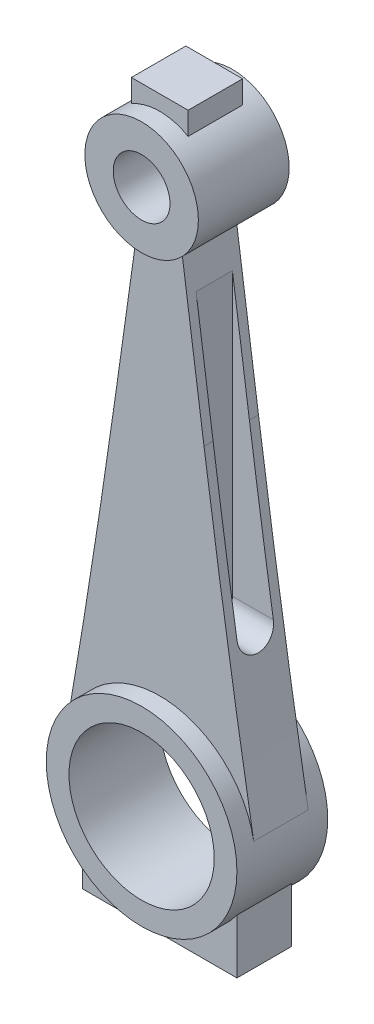
from build123d import *

# Parameters (mm, degrees)
SKETCH2_R             = 12.5
SKETCH2_R_2           = 6.25
BOSS_EXTRUDE3_DEPTH   = 10
SKETCH2_R_3           = 21
SKETCH2_R_4           = 16
BOSS_EXTRUDE3_2_DEPTH = 10
BOSS_EXTRUDE4_DEPTH   = 6
CUT_EXTRUDE2_START    = -6
CUT_EXTRUDE2_DEPTH    = 132.802456026
CUT_EXTRUDE3_START    = 6
CUT_EXTRUDE3_DEPTH    = 132.802456026


with BuildPart() as part:
    # Sketch2 → Boss-Extrude3 (new, symmetric)
    with BuildSketch(Plane.XY):
        with Locations((0, 120)):
            Circle(SKETCH2_R)
        with Locations((0, 120)):
            Circle(SKETCH2_R_2, mode=Mode.SUBTRACT)
    extrude(amount=BOSS_EXTRUDE3_DEPTH, both=True)



with BuildPart() as body_2:
    # Sketch2 → Boss-Extrude3 2 (new, symmetric)
    with BuildSketch(Plane.XY):
        Circle(SKETCH2_R_3)
        Circle(SKETCH2_R_4, mode=Mode.SUBTRACT)
    extrude(amount=BOSS_EXTRUDE3_2_DEPTH, both=True)


with BuildPart() as part_1:
    add(part.part)

    add(body_2.part)  # Boss-Extrude4 merges body 2
    # Sketch2<6> → Boss-Extrude4 (add, symmetric)
    with BuildSketch(Plane.XY):
        with BuildLine():
            Line((6.25, 135.825317547), (-6.25, 135.825317547))
            Line((-6.25, 135.825317547), (-6.25, 130.825317547))
            ThreePointArc((-6.25, 130.825317547), (0, 132.5), (6.25, 130.825317547))
            Line((6.25, 130.825317547), (6.25, 135.825317547))
        make_face()
        with BuildLine():
            Line((-4.824685415, 108.468633617), (-9.743614629, 73.468633617))
            ThreePointArc((-9.743614629, 73.468633617), (-14.942721631, 38.479711201), (-20.693090304, 3.577151615))
            ThreePointArc((-20.693090304, 3.577151615), (0, 21), (20.693090304, 3.577151615))
            ThreePointArc((20.693090304, 3.577151615), (14.942721631, 38.479711201), (9.743614629, 73.468633617))
            Line((9.743614629, 73.468633617), (4.824685415, 108.468633617))
            ThreePointArc((4.824685415, 108.468633617), (0, 107.5), (-4.824685415, 108.468633617))
        make_face()
        with BuildLine():
            Line((-17, -12.328828006), (-17, -24.328828006))
            Line((-17, -24.328828006), (17, -24.328828006))
            Line((17, -24.328828006), (17, -12.328828006))
            ThreePointArc((17, -12.328828006), (0, -21), (-17, -12.328828006))
        make_face()
    extrude(amount=BOSS_EXTRUDE4_DEPTH, both=True)

    # Sketch3 → Cut-Extrude2 (cut, through all)
    with BuildSketch(Plane(origin=(0, 0, 0), x_dir=(0, 0, -1), z_dir=(1, 0, 0)).offset(CUT_EXTRUDE2_START)):
        with BuildLine():
            Line((4, 100), (4, 38))
            ThreePointArc((4, 38), (0, 34), (-4, 38))
            Line((-4, 38), (-4, 100))
            ThreePointArc((-4, 100), (0, 104), (4, 100))
        make_face()
    extrude(amount=-CUT_EXTRUDE2_DEPTH, mode=Mode.SUBTRACT)

    # Sketch3<2> → Cut-Extrude3 (cut, through all)
    with BuildSketch(Plane(origin=(0, 0, 0), x_dir=(0, 0, -1), z_dir=(1, 0, 0)).offset(CUT_EXTRUDE3_START)):
        with BuildLine():
            Line((4, 100), (4, 38))
            ThreePointArc((4, 38), (0, 34), (-4, 38))
            Line((-4, 38), (-4, 100))
            ThreePointArc((-4, 100), (0, 104), (4, 100))
        make_face()
    extrude(amount=CUT_EXTRUDE3_DEPTH, mode=Mode.SUBTRACT)


solid = part_1.part
